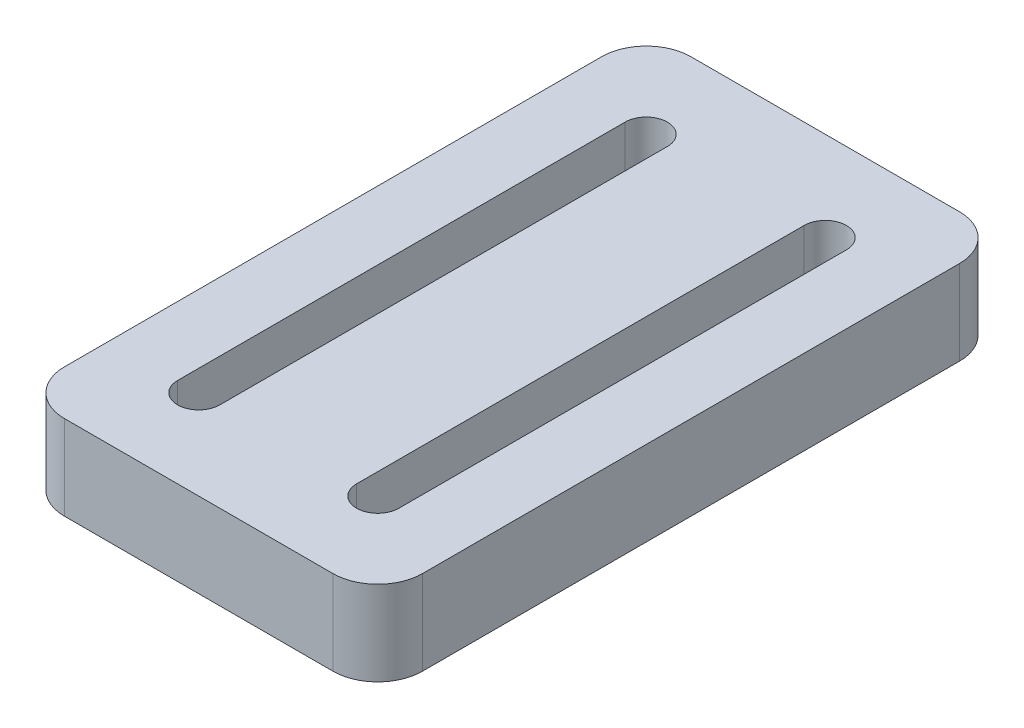
from build123d import *

# Parameters (mm, degrees)
SKETCH1_W           = 25.4
SKETCH1_H           = 44.45
BOSS_EXTRUDE1_DEPTH = 3
FILLET1_R           = 3.175


with BuildPart() as part:
    # Sketch1 → Boss-Extrude1 (new, symmetric)
    with BuildSketch(Plane(origin=(0, 0, 0), x_dir=(1, 0, 0), z_dir=(0, 1, 0))):
        Rectangle(SKETCH1_W, SKETCH1_H)
        with BuildLine():
            Line((-7.85, -15.875), (-7.85, 15.875))
            ThreePointArc((-7.85, 15.875), (-6.35, 17.375), (-4.85, 15.875))
            Line((-4.85, 15.875), (-4.85, -15.875))
            ThreePointArc((-4.85, -15.875), (-6.35, -17.375), (-7.85, -15.875))
        make_face(mode=Mode.SUBTRACT)
        with BuildLine():
            Line((4.85, -15.875), (4.85, 15.875))
            ThreePointArc((4.85, 15.875), (6.35, 17.375), (7.85, 15.875))
            Line((7.85, 15.875), (7.85, -15.875))
            ThreePointArc((7.85, -15.875), (6.35, -17.375), (4.85, -15.875))
        make_face(mode=Mode.SUBTRACT)
    extrude(amount=BOSS_EXTRUDE1_DEPTH, both=True)

    # Fillet1
    fillet1_edges = [part.edges().sort_by_distance(p)[0] for p in [
        (-12.7, 0, -22.225),
        (12.7, 0, -22.225),
        (12.7, 0, 22.225),
        (-12.7, 0, 22.225),
    ]]
    fillet(fillet1_edges, radius=FILLET1_R)


solid = part.part
